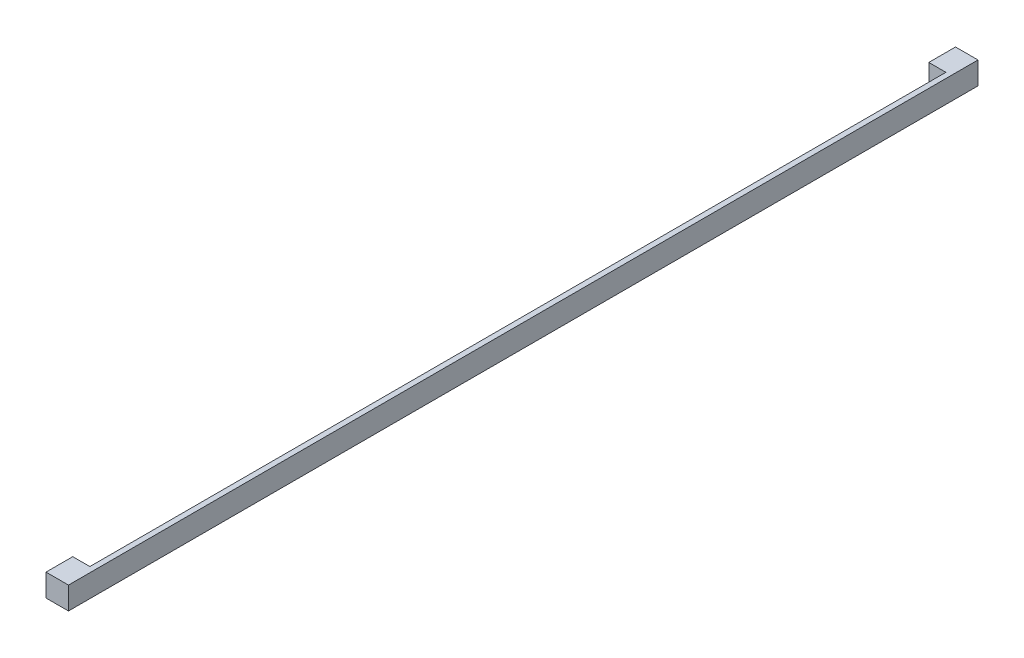
from build123d import *

# Parameters (mm, degrees)
SKETCH_1_W          = 8.4
SKETCH_1_H          = 8.4
EXTRUDE_1_DEPTH     = 340
SKETCH_3_W          = 17.060097013
SKETCH_3_H          = 320
CUT_EXTRUDE_1_DEPTH = 6.4


with BuildPart() as part:
    # Эскиз1 → Бобышка-Вытянуть1 (new body)
    with BuildSketch(Plane.XY):
        Rectangle(SKETCH_1_W, SKETCH_1_H)
    extrude(amount=EXTRUDE_1_DEPTH)

    # Эскиз3 → Вырез-Вытянуть1 (cut)
    with BuildSketch(Plane(origin=(0, 4.2, 0), x_dir=(1, 0, 0), z_dir=(0, 1, 0))):
        with Locations((-6.330048507, -170)):
            Rectangle(SKETCH_3_W, SKETCH_3_H)
    extrude(amount=-CUT_EXTRUDE_1_DEPTH, mode=Mode.SUBTRACT)


solid = part.part
